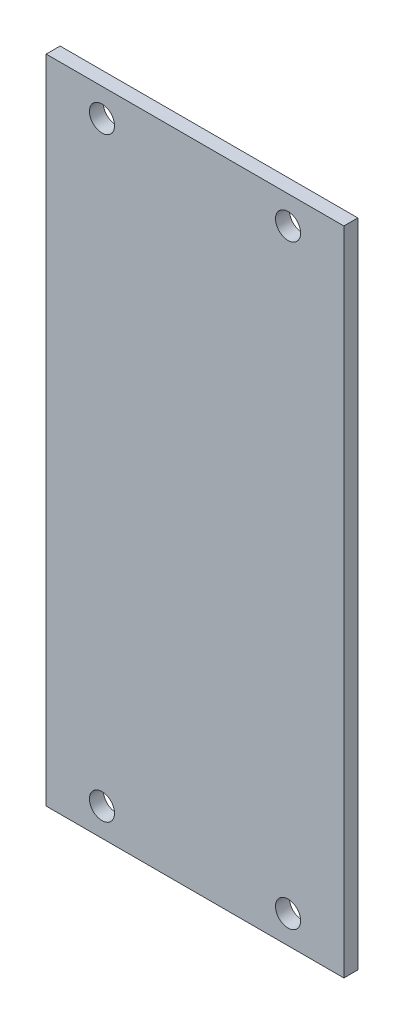
from build123d import *

# Parameters (mm, degrees)
SKETCH1_W           = 64
SKETCH1_H           = 140
SKETCH1_R           = 2.699339217
SKETCH1_W_2         = 52
SKETCH1_H_2         = 110
BOSS_EXTRUDE1_DEPTH = 3


with BuildPart() as part:
    # Sketch1 → Boss-Extrude1 (new body)
    # profile 1 of 2: a face of its own
    with BuildSketch(Plane.XY):
        with Locations((26, -55)):
            Rectangle(SKETCH1_W, SKETCH1_H)
        with Locations((46, 9)):
            Circle(SKETCH1_R, mode=Mode.SUBTRACT)
        with Locations((6, 9)):
            Circle(SKETCH1_R, mode=Mode.SUBTRACT)
        with Locations((46, -119)):
            Circle(SKETCH1_R, mode=Mode.SUBTRACT)
        with Locations((6, -119)):
            Circle(SKETCH1_R, mode=Mode.SUBTRACT)
        with Locations((26, -55)):
            Rectangle(SKETCH1_W_2, SKETCH1_H_2, mode=Mode.SUBTRACT)
    # profile 2 of 2: a face of its own
    with BuildSketch(Plane.XY):
        with Locations((26, -55)):
            Rectangle(SKETCH1_W_2, SKETCH1_H_2)
    extrude(amount=BOSS_EXTRUDE1_DEPTH)


solid = part.part
